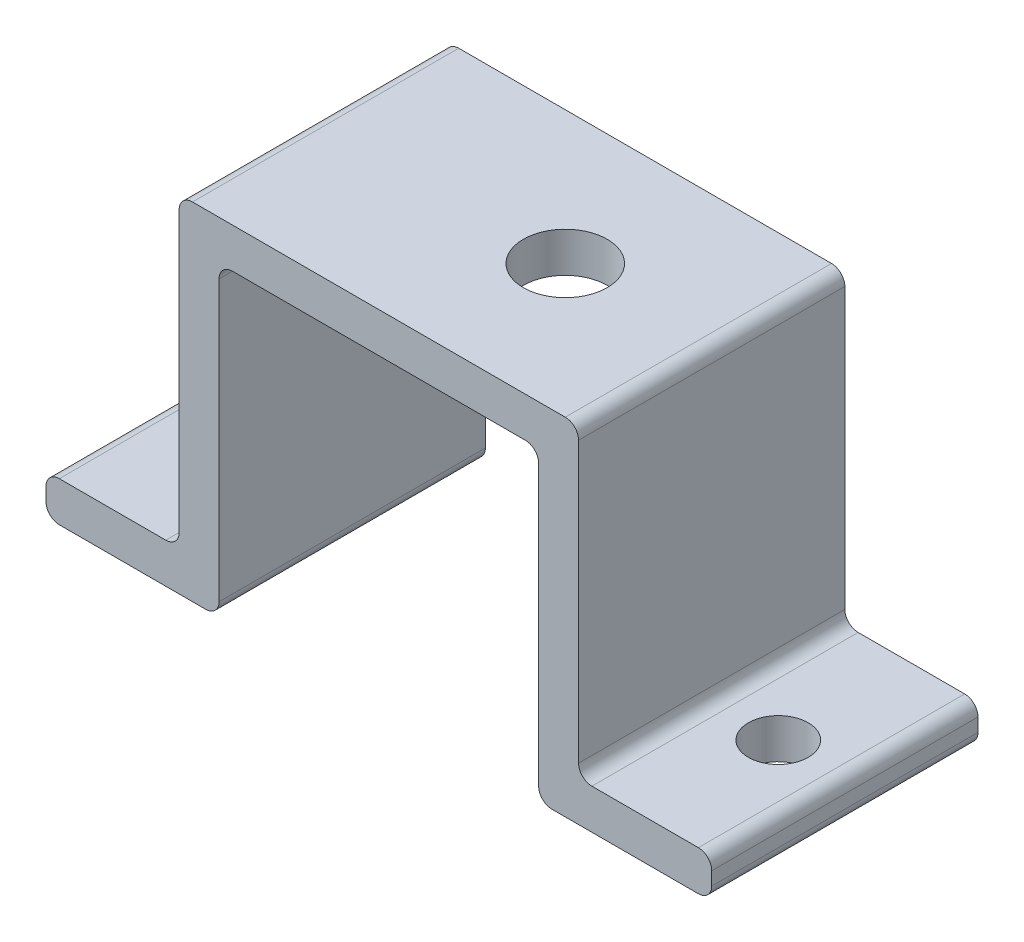
from build123d import *

# Parameters (mm, degrees)
BOSS_EXTRUDE1_DEPTH = 20
SKETCH3_R           = 3.15
CUT_EXTRUDE1_DEPTH  = 42.243181255
SKETCH5_R           = 2.25
CUT_EXTRUDE2_DEPTH  = 40.420806689
FILLET1_R           = 1


with BuildPart() as part:
    # Sketch2 → Boss-Extrude1 (new body)
    with BuildSketch(Plane.XY):
        Polygon((-12, 0), (12, 0), (12, -23), (25, -23), (25, -20), (15, -20), (15, 3), (-15, 3), (-15, -20), (-25, -20), (-25, -23), (-12, -23), align=None)
    extrude(amount=BOSS_EXTRUDE1_DEPTH)

    # Sketch3 → Cut-Extrude1 (cut, through all)
    with BuildSketch(Plane(origin=(0, 3, 0), x_dir=(1, 0, 0), z_dir=(0, 1, 0))):
        with Locations(Location((4, -10, 0), (0, 0, 180))):
            Circle(SKETCH3_R)
    extrude(amount=-CUT_EXTRUDE1_DEPTH, mode=Mode.SUBTRACT)

    # Sketch5 → Cut-Extrude2 (cut, through all)
    with BuildSketch(Plane(origin=(0, -20, 0), x_dir=(1, 0, 0), z_dir=(0, 1, 0))):
        with Locations(Location((-20, -10, 0), (0, 0, 180))):
            Circle(SKETCH5_R)
        with Locations(Location((20, -10, 0), (0, 0, 180))):
            Circle(SKETCH5_R)
    extrude(amount=-CUT_EXTRUDE2_DEPTH, mode=Mode.SUBTRACT)

    # Fillet1
    fillet1_edges = [part.edges().sort_by_distance(p)[0] for p in [
        (15, -20, 10),
        (25, -20, 10),
        (25, -23, 10),
        (12, -23, 10),
        (12, 0, 10),
        (-12, 0, 10),
        (-12, -23, 10),
        (-25, -23, 10),
        (-25, -20, 10),
        (-15, -20, 10),
        (-15, 3, 10),
        (15, 3, 10),
    ]]
    fillet(fillet1_edges, radius=FILLET1_R)


solid = part.part
